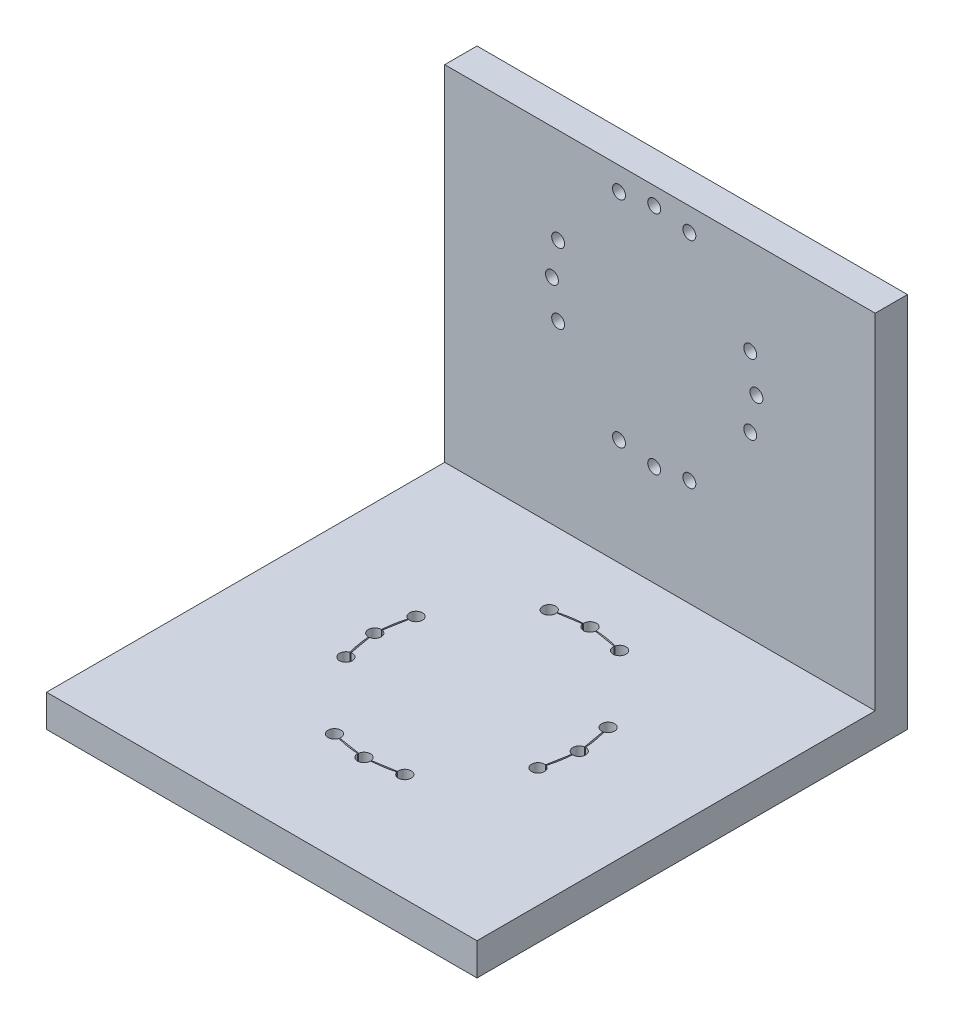
from build123d import *

# Parameters (mm, degrees)
BOSS_EXTRU_1_DEPTH      = 3
ESQUISSE2_W             = 20
ESQUISSE2_H             = 3
BOSS_EXTRU_2_DEPTH      = 32
ESQUISSE3_R             = 0.6
ENL_V_MAT_EXTRU_1_DEPTH = 32


with BuildPart() as part:
    # Esquisse1 → Boss.-Extru.1 (new body)
    with BuildSketch(Plane(origin=(0, 0, 0), x_dir=(1, 0, 0), z_dir=(0, 1, 0))):
        with BuildLine():
            Line((-1.600915354, 17.472527473), (-21.600915354, 17.472527473))
            Line((-21.600915354, 17.472527473), (-21.600915354, -22.527472527))
            Line((-21.600915354, -22.527472527), (-1.600915354, -22.527472527))
            Line((-1.600915354, -22.527472527), (-1.600915354, -14.527472527))
            ThreePointArc((-1.600915354, -14.527472527), (-10.086196728, -11.012753902), (-13.600915354, -2.527472527))
            ThreePointArc((-13.600915354, -2.527472527), (-10.086196728, 5.957808847), (-1.600915354, 9.472527473))
            Line((-1.600915354, 9.472527473), (-1.600915354, 17.472527473))
        make_face()
        with BuildLine():
            Line((-12.100915354, -2.527472527), (-13.600915354, -2.527472527))
            ThreePointArc((-13.600915354, -2.527472527), (-10.086196728, -11.012753902), (-1.600915354, -14.527472527))
            Line((-1.600915354, -14.527472527), (-1.600915354, -13.627472527))
            ThreePointArc((-1.600915354, -13.627472527), (-2.031197653, -13.445631759), (-2.200670406, -13.01032967))
            ThreePointArc((-2.200670406, -13.01032967), (-3.255915354, -12.896222452), (-4.294249093, -12.676164727))
            ThreePointArc((-4.294249093, -12.676164727), (-5.0563189, -13.075940963), (-5.434158505, -12.302760091))
            ThreePointArc((-5.434158505, -12.302760091), (-10.275563851, -8.443592325), (-12.100915354, -2.527472527))
        make_face()
        with BuildLine():
            Line((-1.600915354, 8.572527473), (-1.600915354, 9.472527473))
            ThreePointArc((-1.600915354, 9.472527473), (-10.086196728, 5.957808847), (-13.600915354, -2.527472527))
            Line((-13.600915354, -2.527472527), (-12.100915354, -2.527472527))
            ThreePointArc((-12.100915354, -2.527472527), (-10.275563851, 3.38864727), (-5.434158505, 7.247815036))
            ThreePointArc((-5.434158505, 7.247815036), (-5.0563189, 8.020995908), (-4.294249093, 7.621219672))
            ThreePointArc((-4.294249093, 7.621219672), (-3.255915354, 7.841277397), (-2.200670406, 7.955384615))
            ThreePointArc((-2.200670406, 7.955384615), (-2.031197653, 8.390686704), (-1.600915354, 8.572527473))
        make_face()
        with BuildLine():
            Line((-11.700915354, -2.527472527), (-12.100915354, -2.527472527))
            ThreePointArc((-12.100915354, -2.527472527), (-10.275563851, -8.443592325), (-5.434158505, -12.302760091))
            ThreePointArc((-5.434158505, -12.302760091), (-4.766513404, -11.914665117), (-4.26954033, -12.50575348))
            ThreePointArc((-4.26954033, -12.50575348), (-4.27141827, -12.553187658), (-4.277040334, -12.600324908))
            Line((-4.277040334, -12.600324908), (-2.193415349, -12.932901099))
            ThreePointArc((-2.193415349, -12.932901099), (-1.990310489, -12.570995334), (-1.600915354, -12.427472527))
            Line((-1.600915354, -12.427472527), (-1.600915354, -12.027472527))
            ThreePointArc((-1.600915354, -12.027472527), (-6.796887474, -10.480577187), (-10.300728002, -6.34365647))
            ThreePointArc((-10.300728002, -6.34365647), (-11.087859343, -5.99271332), (-10.712234442, -5.217056968))
            ThreePointArc((-10.712234442, -5.217056968), (-10.955645441, -4.182472527), (-11.081967985, -3.127173284))
            ThreePointArc((-11.081967985, -3.127173284), (-11.518426778, -2.958383435), (-11.700915354, -2.527472527))
        make_face()
        with BuildLine():
            ThreePointArc((-5.434158505, 7.247815036), (-10.275563851, 3.38864727), (-12.100915354, -2.527472527))
            Line((-12.100915354, -2.527472527), (-11.700915354, -2.527472527))
            ThreePointArc((-11.700915354, -2.527472527), (-11.518426778, -2.09656162), (-11.081967985, -1.927771771))
            ThreePointArc((-11.081967985, -1.927771771), (-10.955645441, -0.872472527), (-10.712234442, 0.162111913))
            ThreePointArc((-10.712234442, 0.162111913), (-11.087859343, 0.937768265), (-10.300728002, 1.288711415))
            ThreePointArc((-10.300728002, 1.288711415), (-6.796887474, 5.425632132), (-1.600915354, 6.972527473))
            Line((-1.600915354, 6.972527473), (-1.600915354, 7.372527473))
            ThreePointArc((-1.600915354, 7.372527473), (-1.990310489, 7.516050279), (-2.193415349, 7.877956044))
            Line((-2.193415349, 7.877956044), (-4.277040334, 7.545379853))
            ThreePointArc((-4.277040334, 7.545379853), (-4.27141827, 7.498242603), (-4.26954033, 7.450808425))
            ThreePointArc((-4.26954033, 7.450808425), (-4.766513404, 6.859720062), (-5.434158505, 7.247815036))
        make_face()
        with BuildLine():
            Line((-1.600915354, -2.527472527), (-1.600915354, 6.972527473))
            ThreePointArc((-1.600915354, 6.972527473), (-6.796887474, 5.425632132), (-10.300728002, 1.288711415))
            ThreePointArc((-10.300728002, 1.288711415), (-10.027222023, 1.06797018), (-9.924278512, 0.731912377))
            ThreePointArc((-9.924278512, 0.731912377), (-10.138737197, 0.27217561), (-10.628804827, 0.141087318))
            Line((-10.628804827, 0.141087318), (-10.996389038, -1.936647469))
            ThreePointArc((-10.996389038, -1.936647469), (-10.641178587, -2.141931213), (-10.500915354, -2.527472527))
            ThreePointArc((-10.500915354, -2.527472527), (-10.641178587, -2.913013842), (-10.996389038, -3.118297586))
            Line((-10.996389038, -3.118297586), (-10.628804827, -5.196032373))
            ThreePointArc((-10.628804827, -5.196032373), (-10.138737197, -5.327120665), (-9.924278512, -5.786857431))
            ThreePointArc((-9.924278512, -5.786857431), (-10.027222023, -6.122915235), (-10.300728002, -6.34365647))
            ThreePointArc((-10.300728002, -6.34365647), (-6.796887474, -10.480577187), (-1.600915354, -12.027472527))
            Line((-1.600915354, -12.027472527), (-1.600915354, -2.527472527))
        make_face()
        with BuildLine():
            ThreePointArc((7.098897295, 1.288711415), (3.595056766, 5.425632132), (-1.600915354, 6.972527473))
            Line((-1.600915354, 6.972527473), (-1.600915354, -2.527472527))
            Line((-1.600915354, -2.527472527), (-1.600915354, -12.027472527))
            ThreePointArc((-1.600915354, -12.027472527), (3.595056766, -10.480577187), (7.098897295, -6.34365647))
            ThreePointArc((7.098897295, -6.34365647), (6.745557904, -5.621939139), (7.42697412, -5.196032373))
            Line((7.42697412, -5.196032373), (7.794558331, -3.118297586))
            ThreePointArc((7.794558331, -3.118297586), (7.299084646, -2.527472527), (7.794558331, -1.936647469))
            Line((7.794558331, -1.936647469), (7.42697412, 0.141087318))
            ThreePointArc((7.42697412, 0.141087318), (6.745557904, 0.566994084), (7.098897295, 1.288711415))
        make_face()
        with BuildLine():
            ThreePointArc((2.232327798, -12.302760091), (7.073733143, -8.443592325), (8.899084646, -2.527472527))
            Line((8.899084646, -2.527472527), (8.499084646, -2.527472527))
            ThreePointArc((8.499084646, -2.527472527), (8.316596071, -2.958383435), (7.880137278, -3.127173284))
            ThreePointArc((7.880137278, -3.127173284), (7.753814733, -4.182472527), (7.510403735, -5.217056968))
            ThreePointArc((7.510403735, -5.217056968), (7.80864404, -5.435270713), (7.922447804, -5.786857431))
            ThreePointArc((7.922447804, -5.786857431), (7.658505607, -6.28391392), (7.098897295, -6.34365647))
            ThreePointArc((7.098897295, -6.34365647), (3.595056766, -10.480577187), (-1.600915354, -12.027472527))
            Line((-1.600915354, -12.027472527), (-1.600915354, -12.427472527))
            ThreePointArc((-1.600915354, -12.427472527), (-1.211520218, -12.570995334), (-1.008415358, -12.932901099))
            Line((-1.008415358, -12.932901099), (1.075209627, -12.600324908))
            ThreePointArc((1.075209627, -12.600324908), (1.518275509, -11.92466016), (2.232327798, -12.302760091))
        make_face()
        with BuildLine():
            Line((8.499084646, -2.527472527), (8.899084646, -2.527472527))
            ThreePointArc((8.899084646, -2.527472527), (7.073733143, 3.38864727), (2.232327798, 7.247815036))
            ThreePointArc((2.232327798, 7.247815036), (1.518275509, 6.869715106), (1.075209627, 7.545379853))
            Line((1.075209627, 7.545379853), (-1.008415358, 7.877956044))
            ThreePointArc((-1.008415358, 7.877956044), (-1.211520218, 7.516050279), (-1.600915354, 7.372527473))
            Line((-1.600915354, 7.372527473), (-1.600915354, 6.972527473))
            ThreePointArc((-1.600915354, 6.972527473), (3.595056766, 5.425632132), (7.098897295, 1.288711415))
            ThreePointArc((7.098897295, 1.288711415), (7.658505607, 1.228968865), (7.922447804, 0.731912377))
            ThreePointArc((7.922447804, 0.731912377), (7.80864404, 0.380325658), (7.510403735, 0.162111913))
            ThreePointArc((7.510403735, 0.162111913), (7.753814733, -0.872472527), (7.880137278, -1.927771771))
            ThreePointArc((7.880137278, -1.927771771), (8.316596071, -2.09656162), (8.499084646, -2.527472527))
        make_face()
        with BuildLine():
            ThreePointArc((10.399084646, -2.527472527), (6.884366021, 5.957808847), (-1.600915354, 9.472527473))
            Line((-1.600915354, 9.472527473), (-1.600915354, 8.572527473))
            ThreePointArc((-1.600915354, 8.572527473), (-1.176651285, 8.396791541), (-1.000915354, 7.972527473))
            ThreePointArc((-1.000915354, 7.972527473), (-1.000976594, 7.963955169), (-1.001160302, 7.955384615))
            ThreePointArc((-1.001160302, 7.955384615), (0.054084646, 7.841277397), (1.092418386, 7.621219672))
            ThreePointArc((1.092418386, 7.621219672), (1.753806249, 8.044599104), (2.267709623, 7.450808425))
            ThreePointArc((2.267709623, 7.450808425), (2.258797985, 7.347781499), (2.232327798, 7.247815036))
            ThreePointArc((2.232327798, 7.247815036), (7.073733143, 3.38864727), (8.899084646, -2.527472527))
            Line((8.899084646, -2.527472527), (10.399084646, -2.527472527))
        make_face()
        with BuildLine():
            ThreePointArc((-1.600915354, -14.527472527), (6.884366021, -11.012753902), (10.399084646, -2.527472527))
            Line((10.399084646, -2.527472527), (8.899084646, -2.527472527))
            ThreePointArc((8.899084646, -2.527472527), (7.073733143, -8.443592325), (2.232327798, -12.302760091))
            ThreePointArc((2.232327798, -12.302760091), (2.258797985, -12.402726554), (2.267709623, -12.50575348))
            ThreePointArc((2.267709623, -12.50575348), (1.753806249, -13.099544159), (1.092418386, -12.676164727))
            ThreePointArc((1.092418386, -12.676164727), (0.054084646, -12.896222452), (-1.001160302, -13.01032967))
            ThreePointArc((-1.001160302, -13.01032967), (-1.000976594, -13.018900224), (-1.000915354, -13.027472527))
            ThreePointArc((-1.000915354, -13.027472527), (-1.176651285, -13.451736596), (-1.600915354, -13.627472527))
            Line((-1.600915354, -13.627472527), (-1.600915354, -14.527472527))
        make_face()
        with BuildLine():
            Line((18.399084646, 17.472527473), (-1.600915354, 17.472527473))
            Line((-1.600915354, 17.472527473), (-1.600915354, 9.472527473))
            ThreePointArc((-1.600915354, 9.472527473), (6.884366021, 5.957808847), (10.399084646, -2.527472527))
            ThreePointArc((10.399084646, -2.527472527), (6.884366021, -11.012753902), (-1.600915354, -14.527472527))
            Line((-1.600915354, -14.527472527), (-1.600915354, -22.527472527))
            Line((-1.600915354, -22.527472527), (18.399084646, -22.527472527))
            Line((18.399084646, -22.527472527), (18.399084646, 17.472527473))
        make_face()
    extrude(amount=BOSS_EXTRU_1_DEPTH)

    # Esquisse2 → Boss.-Extru.2 (add)
    with BuildSketch(Plane(origin=(0, 3, 0), x_dir=(1, 0, 0), z_dir=(0, 1, 0))):
        with Locations((-11.600915354, 15.972527473)):
            Rectangle(ESQUISSE2_W, ESQUISSE2_H)
        with Locations((8.399084646, 15.972527473)):
            Rectangle(ESQUISSE2_W, ESQUISSE2_H)
    extrude(amount=BOSS_EXTRU_2_DEPTH)

    # Esquisse3 → Enlèv. mat.-Extru.1 (cut)
    with BuildSketch(Plane.XY.offset(-14.472527473)):
        with Locations((7.362779374, 22.8773094)):
            Circle(ESQUISSE3_R)
        with Locations((-11.637220626, 22.8773094)):
            Circle(ESQUISSE3_R)
        with Locations((-2.137220626, 33.3773094)):
            Circle(ESQUISSE3_R)
        with Locations((-2.137220626, 12.3773094)):
            Circle(ESQUISSE3_R)
        with Locations((1.13140435, 32.855590352)):
            Circle(ESQUISSE3_R)
        with Locations((-5.405845603, 32.855590352)):
            Circle(ESQUISSE3_R)
        with Locations((-5.405845603, 12.899028447)):
            Circle(ESQUISSE3_R)
        with Locations((1.13140435, 12.899028447)):
            Circle(ESQUISSE3_R)
        with Locations((-11.060583784, 26.136694304)):
            Circle(ESQUISSE3_R)
        with Locations((-11.060583784, 19.617924496)):
            Circle(ESQUISSE3_R)
        with Locations((6.786142531, 26.136694304)):
            Circle(ESQUISSE3_R)
        with Locations((6.786142531, 19.617924496)):
            Circle(ESQUISSE3_R)
    extrude(amount=-ENL_V_MAT_EXTRU_1_DEPTH, mode=Mode.SUBTRACT)


solid = part.part
